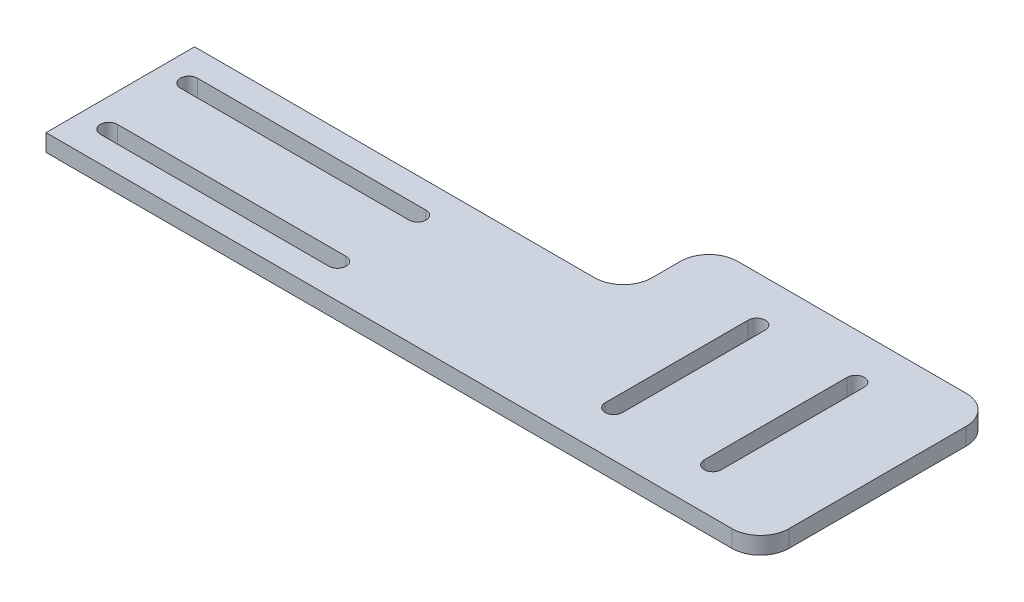
from build123d import *

# Parameters (mm, degrees)
BOSS_EXTRUDE1_DEPTH = 3
CUT_EXTRUDE1_DEPTH  = 3
FILLET1_R           = 5
CUT_EXTRUDE2_DEPTH  = 128.710610366


with BuildPart() as part:
    # Sketch1 → Boss-Extrude1 (new body)
    with BuildSketch(Plane(origin=(0, 0, 0), x_dir=(1, 0, 0), z_dir=(0, 1, 0))):
        Polygon((0, 0), (75, 0), (75, 15), (125, 15), (125, -26), (0, -26), align=None)
    extrude(amount=BOSS_EXTRUDE1_DEPTH)

    # Sketch2 → Cut-Extrude1 (cut)
    with BuildSketch(Plane(origin=(0, 3, 0), x_dir=(1, 0, 0), z_dir=(0, 1, 0))):
        with BuildLine():
            Line((92.84, 7), (92.84, -18))
            ThreePointArc((92.84, -18), (91.34, -19.5), (89.84, -18))
            Line((89.84, -18), (89.84, 7))
            ThreePointArc((89.84, 7), (91.34, 8.5), (92.84, 7))
        make_face()
        with BuildLine():
            Line((107.16, 7), (107.16, -18))
            ThreePointArc((107.16, -18), (108.66, -19.5), (110.16, -18))
            Line((110.16, -18), (110.16, 7))
            ThreePointArc((110.16, 7), (108.66, 8.5), (107.16, 7))
        make_face()
    extrude(amount=-CUT_EXTRUDE1_DEPTH, mode=Mode.SUBTRACT)

    # Fillet1
    fillet1_edges = [part.edges().sort_by_distance(p)[0] for p in [
        (75, 1.5, 0),
        (75, 1.5, -15),
        (125, 1.5, -15),
        (125, 1.5, 26),
    ]]
    fillet(fillet1_edges, radius=FILLET1_R)

    # Sketch4 → Cut-Extrude2 (cut, through all)
    with BuildSketch(Plane(origin=(0, 3, 0), x_dir=(1, 0, 0), z_dir=(0, 1, 0))):
        with BuildLine():
            Line((45, -21.5), (5, -21.5))
            ThreePointArc((5, -21.5), (3.5, -20), (5, -18.5))
            Line((5, -18.5), (45, -18.5))
            ThreePointArc((45, -18.5), (46.5, -20), (45, -21.5))
        make_face()
        with BuildLine():
            Line((45, -4.5), (5, -4.5))
            ThreePointArc((5, -4.5), (3.5, -6), (5, -7.5))
            Line((5, -7.5), (45, -7.5))
            ThreePointArc((45, -7.5), (46.5, -6), (45, -4.5))
        make_face()
    extrude(amount=-CUT_EXTRUDE2_DEPTH, mode=Mode.SUBTRACT)


solid = part.part
